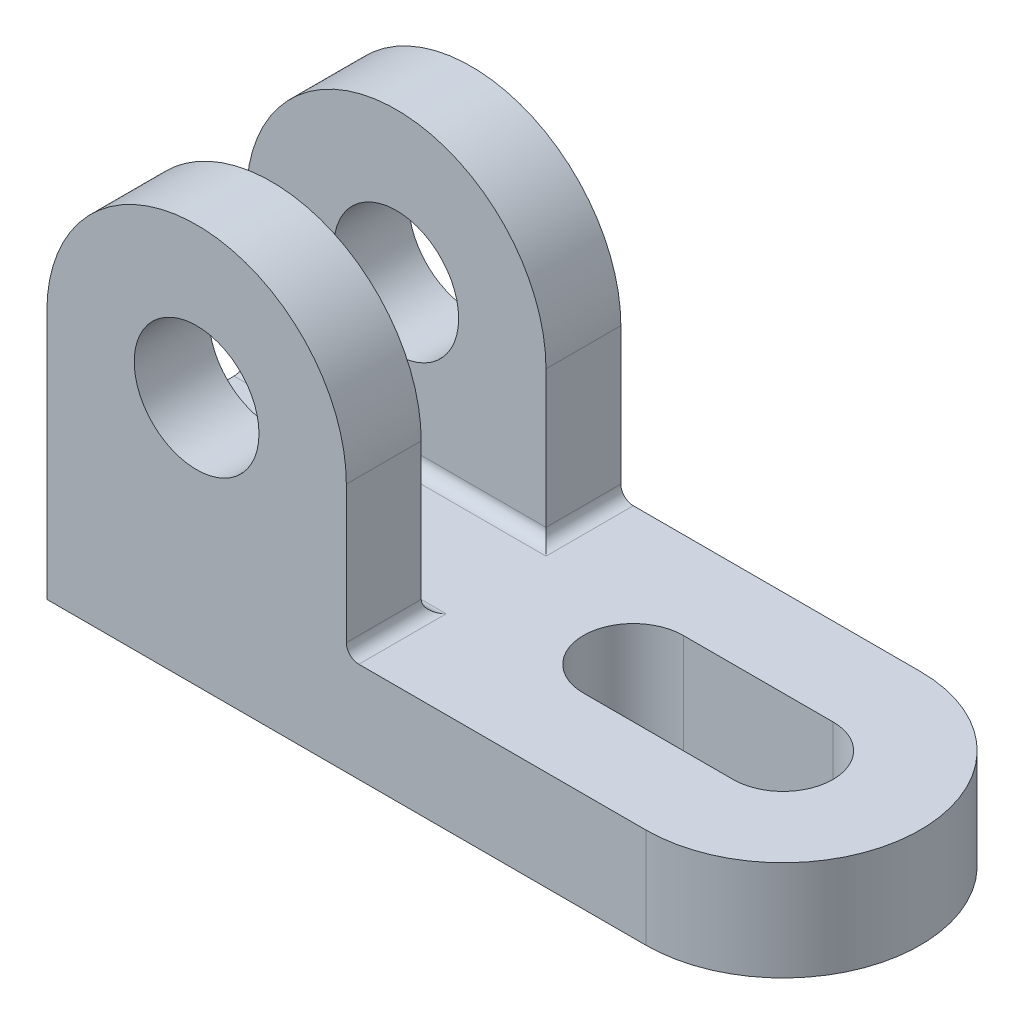
from build123d import *

# Parameters (mm, degrees)
BOSS_EXTRUDE1_DEPTH = 16
CUT_EXTRUDE1_REACH  = 66.969
BOSS_EXTRUDE2_DEPTH = 12
FILLET1_R           = 2


with BuildPart() as part:
    # Sketch1 → Boss-Extrude1 (new body)
    with BuildSketch(Plane(origin=(0, 0, 0), x_dir=(1, 0, 0), z_dir=(0, 1, 0))):
        with BuildLine():
            Line((-59, 22), (37, 22))
            ThreePointArc((37, 22), (59, 0), (37, -22))
            Line((37, -22), (-59, -22))
            Line((-59, -22), (-59, 22))
        make_face()
    extrude(amount=BOSS_EXTRUDE1_DEPTH)

    # Sketch2 → Cut-Extrude1 (cut, up to next)
    with BuildSketch(Plane(origin=(0, 16, 0), x_dir=(1, 0, 0), z_dir=(0, 1, 0)), mode=Mode.PRIVATE) as cut_extrude1_sk1:
        with BuildLine():
            Line((37, -8), (13, -8))
            ThreePointArc((13, -8), (5, 0), (13, 8))
            Line((13, 8), (37, 8))
            ThreePointArc((37, 8), (45, 0), (37, -8))
        make_face()
    cut_extrude1_tool1 = extrude(cut_extrude1_sk1.sketch, amount=-CUT_EXTRUDE1_REACH, mode=Mode.PRIVATE) & part.part
    add(cut_extrude1_tool1.solids().sort_by_distance((25, 16, 0))[0], mode=Mode.SUBTRACT)

    # Sketch3 → Boss-Extrude2 (add)
    with BuildSketch(Plane.XY.offset(22)):
        with BuildLine():
            Line((-59, 40), (-59, 16))
            Line((-59, 16), (-35, 16))
            ThreePointArc((-35, 16), (-51.970562748, 23.029437252), (-59, 40))
        make_face()
        Polygon((-59, 16), (-59, 0), (-11, 0), (-11, 16), (-35, 16), align=None)
        with BuildLine():
            Line((-35, 16), (-11, 16))
            Line((-11, 16), (-11, 40))
            ThreePointArc((-11, 40), (-18.029437252, 23.029437252), (-35, 16))
        make_face()
        with BuildLine():
            ThreePointArc((-11, 40), (-35, 64), (-59, 40))
            Line((-59, 40), (-45, 40))
            ThreePointArc((-45, 40), (-35, 50), (-25, 40))
            Line((-25, 40), (-11, 40))
        make_face()
        with BuildLine():
            Line((-45, 40), (-59, 40))
            ThreePointArc((-59, 40), (-51.970562748, 23.029437252), (-35, 16))
            ThreePointArc((-35, 16), (-18.029437252, 23.029437252), (-11, 40))
            Line((-11, 40), (-25, 40))
            ThreePointArc((-25, 40), (-35, 30), (-45, 40))
        make_face()
    boss_extrude2 = extrude(amount=-BOSS_EXTRUDE2_DEPTH)

    # Mirror1: Boss-Extrude2 across plane
    add(boss_extrude2.mirror(Plane.XY))

    # Fillet1
    fillet1_edges = [part.edges().sort_by_distance(p)[0] for p in [
        (-35, 16, 10),
        (-11, 16, 16),
        (-11, 16, -16),
        (-35, 16, -10),
    ]]
    fillet(fillet1_edges, radius=FILLET1_R)


solid = part.part
